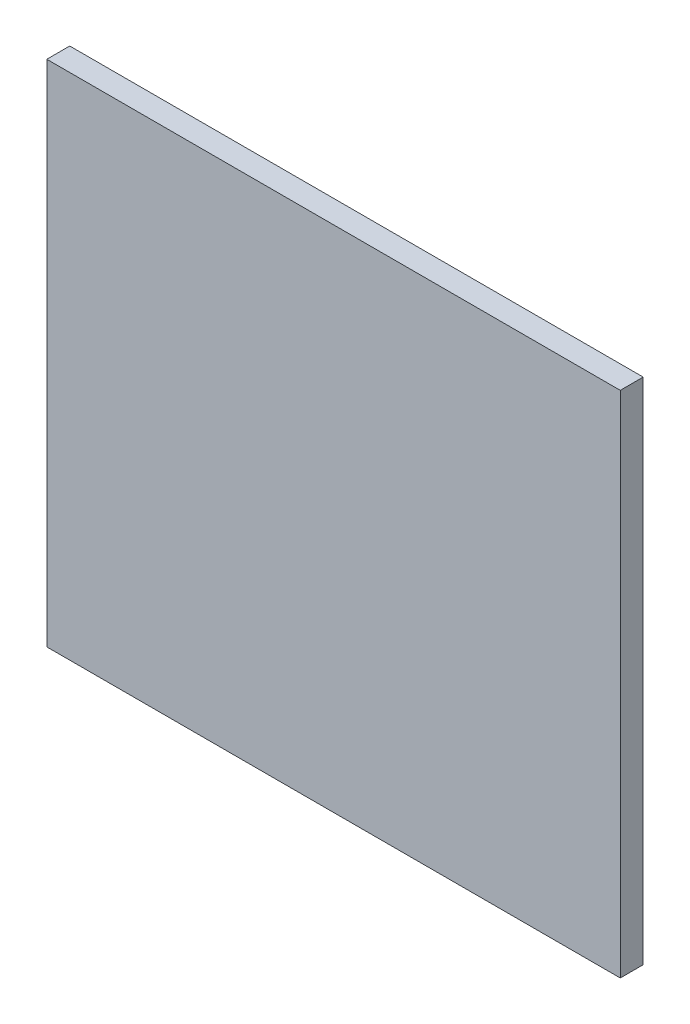
from build123d import *

# Parameters (mm, degrees)
SKETCH_1_W      = 400
SKETCH_1_H      = 355
EXTRUDE_1_DEPTH = 16


with BuildPart() as part:
    # 草图1 → 凸台-拉伸1 (new body)
    with BuildSketch(Plane.XY):
        Rectangle(SKETCH_1_W, SKETCH_1_H)
    extrude(amount=EXTRUDE_1_DEPTH)


solid = part.part
